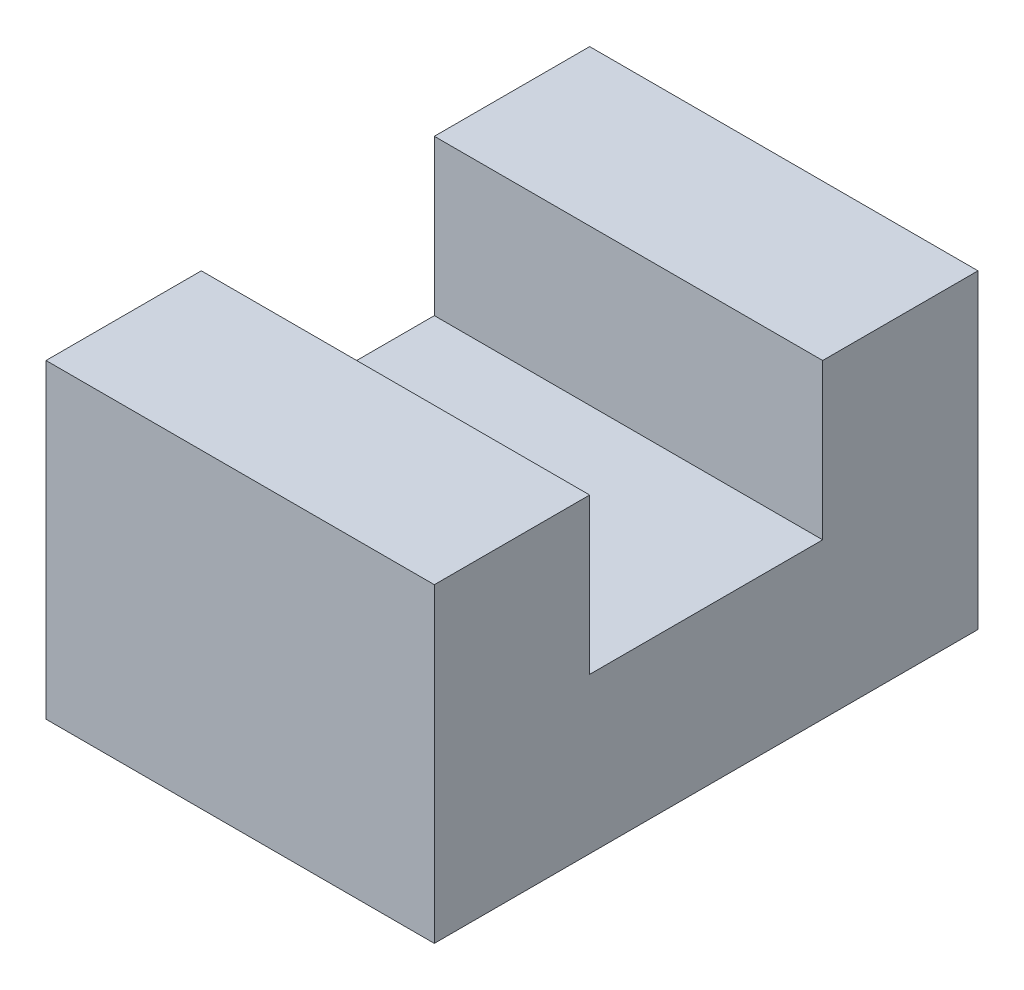
from build123d import *

# Parameters (mm, degrees)
SKETCH1_W           = 5
SKETCH1_H           = 7
BOSS_EXTRUDE1_DEPTH = 2
SKETCH2_W           = 5
SKETCH2_H           = 2
BOSS_EXTRUDE2_DEPTH = 2


with BuildPart() as part:
    # Sketch1 → Boss-Extrude1 (new body)
    with BuildSketch(Plane(origin=(0, 0, 0), x_dir=(1, 0, 0), z_dir=(0, 1, 0))):
        with Locations((-7.552412901, -26.14173035)):
            Rectangle(SKETCH1_W, SKETCH1_H)
    extrude(amount=BOSS_EXTRUDE1_DEPTH)

    # Sketch2 → Boss-Extrude2 (add)
    with BuildSketch(Plane(origin=(0, 2, 0), x_dir=(1, 0, 0), z_dir=(0, 1, 0))):
        with Locations((-7.552412901, -23.64173035)):
            Rectangle(SKETCH2_W, SKETCH2_H)
        with Locations((-7.552412901, -28.64173035)):
            Rectangle(SKETCH2_W, SKETCH2_H)
    extrude(amount=BOSS_EXTRUDE2_DEPTH)


solid = part.part
